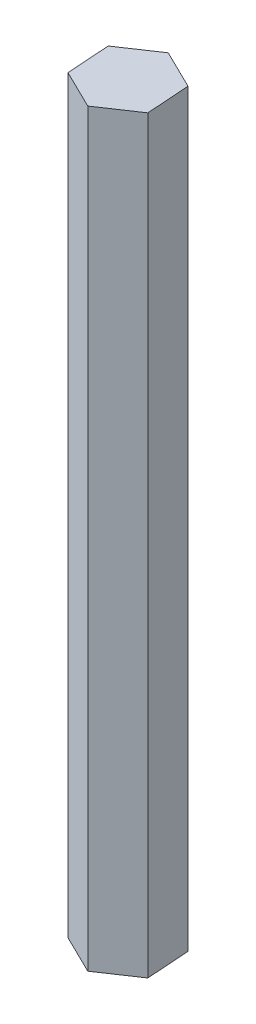
from build123d import *

# Parameters (mm, degrees)
BOSS_EXTRUDE1_DEPTH = 63.5


with BuildPart() as part:
    # Sketch1 → Boss-Extrude1 (new, symmetric)
    with BuildSketch(Plane(origin=(0, 0, 0), x_dir=(1, 0, 0), z_dir=(0, 1, 0))):
        Polygon((6.086869898, 4.0881962), (-0.497046816, 7.315482062), (-6.583916714, 3.227285861), (-6.086869898, -4.0881962), (0.497046816, -7.315482062), (6.583916714, -3.227285861), align=None)
    extrude(amount=BOSS_EXTRUDE1_DEPTH, both=True)


solid = part.part
